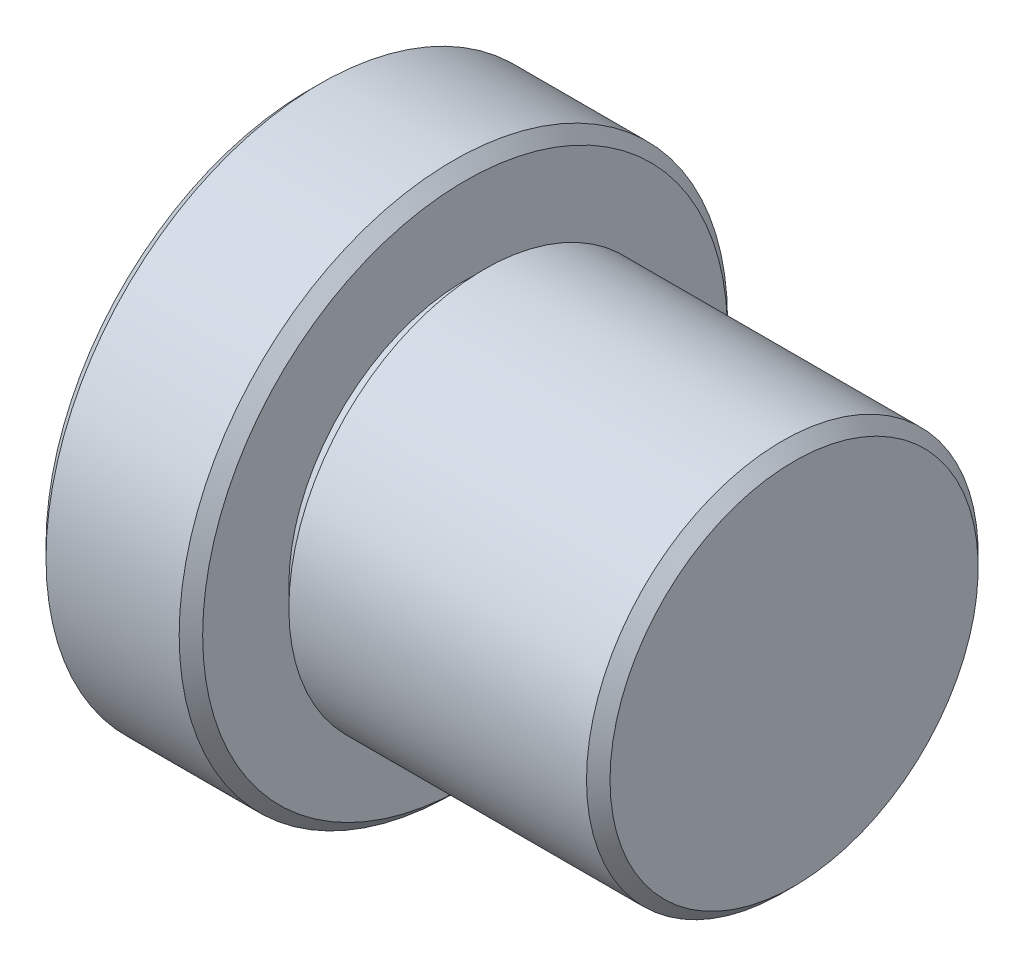
from build123d import *

# Parameters (mm, degrees)
ENL_V_MAT_EXTRU_1_DEPTH = 8


with BuildPart() as part:
    # Esquisse1 → Révolution1 (revolve)
    with BuildSketch(Plane.XY, mode=Mode.PRIVATE) as r_volution1_sk:
        Polygon((0, 0), (0, 6.7), (0.3, 7), (3.7, 7), (4, 6.7), (4, 4.5), (4.5, 4.5), (4.5, 5), (12.1, 5), (12.4, 4.7), (12.4, 0), align=None)
    revolve(r_volution1_sk.sketch.rotate(Axis((-14.206779661, 0, 0), (1, 0, 0)), 90), axis=Axis((-14.206779661, 0, 0), (1, 0, 0)))

    # Esquisse2 → Enlèv. mat.-Extru.1 (cut)
    with BuildSketch(Plane.ZY):
        Polygon((-1.443375673, 2.5), (1.443375673, 2.5), (2.886751346, 0), (1.443375673, -2.5), (-1.443375673, -2.5), (-2.886751346, 0), align=None)
    extrude(amount=-ENL_V_MAT_EXTRU_1_DEPTH, mode=Mode.SUBTRACT)


solid = part.part
